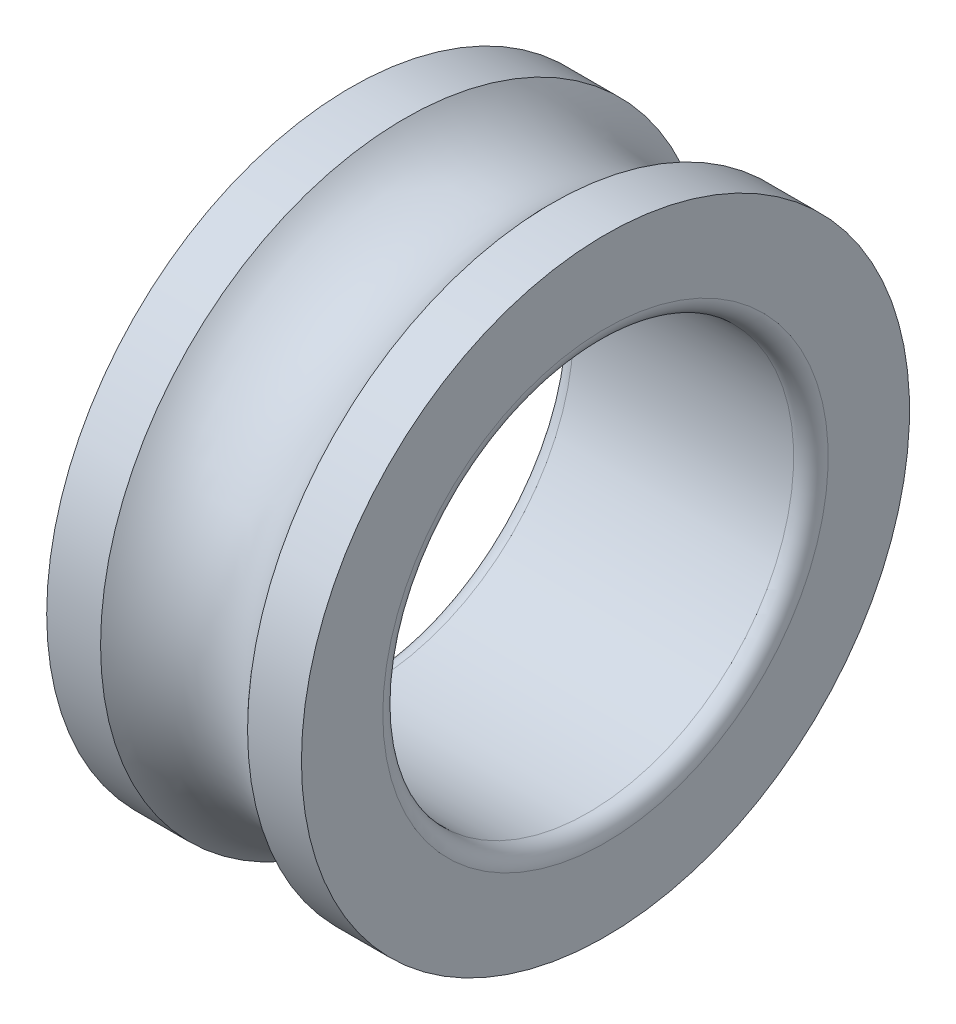
from build123d import *


with BuildPart() as part:
    # Sketch1 → Revolve1 (revolve)
    with BuildSketch(Plane.XY, mode=Mode.PRIVATE) as revolve1_sk:
        with BuildLine():
            Line((13.4, 25), (-13.4, 25))
            ThreePointArc((-13.4, 25), (-14.88492424, 25.61507576), (-15.5, 27.1))
            Line((-15.5, 27.1), (-15.5, 37))
            Line((-15.5, 37), (-8.94427191, 37))
            ThreePointArc((-8.94427191, 37), (0, 33), (8.94427191, 37))
            Line((8.94427191, 37), (15.5, 37))
            Line((15.5, 37), (15.5, 27.1))
            ThreePointArc((15.5, 27.1), (14.88492424, 25.61507576), (13.4, 25))
        make_face()
    revolve(revolve1_sk.sketch.rotate(Axis((-9.869387755, 0, 0), (1, 0, 0)), 90), axis=Axis((-9.869387755, 0, 0), (1, 0, 0)))


solid = part.part
